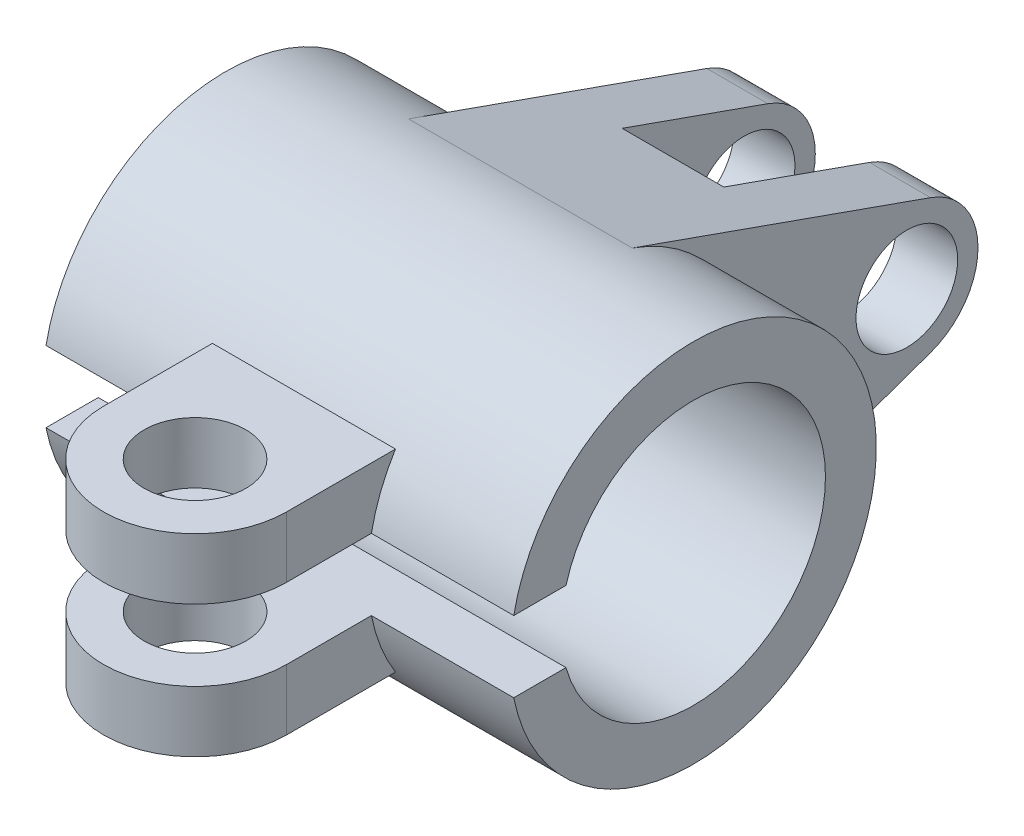
from build123d import *

# Parameters (mm, degrees)
BOSS_EXTRUDE1_DEPTH     = 23
BOSS_EXTRUDE3_DEPTH     = 11
BOSS_EXTRUDE4_START     = 5
SKETCH1_5_R             = 7
SKETCH1_5_R_2           = 5
BOSS_EXTRUDE4_DEPTH     = 6
BOSS_EXTRUDE5_START     = -11
SKETCH1_6_R             = 7
SKETCH1_6_R_2           = 5
BOSS_EXTRUDE5_DEPTH     = 6
BOSS_EXTRUDE6_DEPTH     = 9
FILLET5_RADIUS          = 9
FILLET5_LENGTH          = 6
FILLET6_RADIUS          = 9
FILLET6_LENGTH          = 6
CUT_EXTRUDE1_DEPTH      = 54.714523176
CUT_EXTRUDE1_DEPTH_BACK = 54.714523176
SKETCH3_R               = 5


with BuildPart() as part:
    # Sketch1 → Boss-Extrude1 (new, symmetric)
    with BuildSketch(Plane(origin=(0, 0, 0), x_dir=(0, 0, -1), z_dir=(1, 0, 0))):
        with BuildLine():
            Line((-17.656443583, 3.5), (-12.519984026, 3.5))
            ThreePointArc((-12.519984026, 3.5), (1.766381565, 12.879436951), (13, 0))
            ThreePointArc((13, 0), (1.766381565, -12.879436951), (-12.519984026, -3.5))
            Line((-12.519984026, -3.5), (-17.656443583, -3.5))
            ThreePointArc((-17.656443583, -3.5), (-16.743615691, -6.606915588), (-15.288884851, -9.5))
            ThreePointArc((-15.288884851, -9.5), (-5.96013191, -16.984605607), (6, -16.970562748))
            ThreePointArc((6, -16.970562748), (14.696938457, -10.392304845), (18, 0))
            ThreePointArc((18, 0), (14.696938457, 10.392304845), (6, 16.970562748))
            ThreePointArc((6, 16.970562748), (-5.96013191, 16.984605607), (-15.288884851, 9.5))
            ThreePointArc((-15.288884851, 9.5), (-16.743615691, 6.606915588), (-17.656443583, 3.5))
        make_face()
    extrude(amount=BOSS_EXTRUDE1_DEPTH, both=True)

    # Sketch1<4> → Boss-Extrude3 (add, symmetric)
    with BuildSketch(Plane(origin=(0, 0, 0), x_dir=(0, 0, -1), z_dir=(1, 0, 0))):
        with BuildLine():
            Line((21, 11.66726189), (6, 16.970562748))
            ThreePointArc((6, 16.970562748), (14.696938457, 10.392304845), (18, 0))
            ThreePointArc((18, 0), (14.696938457, -10.392304845), (6, -16.970562748))
            Line((6, -16.970562748), (21, -11.66726189))
            Line((21, -11.66726189), (21, 11.66726189))
        make_face()
    extrude(amount=BOSS_EXTRUDE3_DEPTH, both=True)

    # Sketch1<5> → Boss-Extrude4 (add)
    # profile 1 of 2: a face of its own
    with BuildSketch(Plane(origin=(0, 0, 0), x_dir=(0, 0, -1), z_dir=(1, 0, 0)).offset(BOSS_EXTRUDE4_START)):
        with BuildLine():
            Line((35.333333333, 6.599663291), (21, 11.66726189))
            Line((21, 11.66726189), (21, -11.66726189))
            Line((21, -11.66726189), (35.333333333, -6.599663291))
            ThreePointArc((35.333333333, -6.599663291), (26, 0), (35.333333333, 6.599663291))
        make_face()
    # profile 2 of 2: a face of its own
    with BuildSketch(Plane(origin=(0, 0, 0), x_dir=(0, 0, -1), z_dir=(1, 0, 0)).offset(BOSS_EXTRUDE4_START)):
        with Locations((33, 0)):
            Circle(SKETCH1_5_R)
        with Locations((33, 0)):
            Circle(SKETCH1_5_R_2, mode=Mode.SUBTRACT)
    extrude(amount=BOSS_EXTRUDE4_DEPTH)

    # Sketch1<6> → Boss-Extrude5 (add)
    # profile 1 of 2: a face of its own
    with BuildSketch(Plane(origin=(0, 0, 0), x_dir=(0, 0, -1), z_dir=(1, 0, 0)).offset(BOSS_EXTRUDE5_START)):
        with BuildLine():
            Line((35.333333333, 6.599663291), (21, 11.66726189))
            Line((21, 11.66726189), (21, -11.66726189))
            Line((21, -11.66726189), (35.333333333, -6.599663291))
            ThreePointArc((35.333333333, -6.599663291), (26, 0), (35.333333333, 6.599663291))
        make_face()
    # profile 2 of 2: a face of its own
    with BuildSketch(Plane(origin=(0, 0, 0), x_dir=(0, 0, -1), z_dir=(1, 0, 0)).offset(BOSS_EXTRUDE5_START)):
        with Locations((33, 0)):
            Circle(SKETCH1_6_R)
        with Locations((33, 0)):
            Circle(SKETCH1_6_R_2, mode=Mode.SUBTRACT)
    extrude(amount=BOSS_EXTRUDE5_DEPTH)

    # Sketch1<8> → Boss-Extrude6 (add, symmetric)
    with BuildSketch(Plane(origin=(0, 0, 0), x_dir=(0, 0, -1), z_dir=(1, 0, 0))):
        with BuildLine():
            Line((-35, 3.5), (-17.656443583, 3.5))
            ThreePointArc((-17.656443583, 3.5), (-16.743615691, 6.606915588), (-15.288884851, 9.5))
            Line((-15.288884851, 9.5), (-35, 9.5))
            Line((-35, 9.5), (-35, 3.5))
        make_face()
        with BuildLine():
            ThreePointArc((-15.288884851, -9.5), (-16.743615691, -6.606915588), (-17.656443583, -3.5))
            Line((-17.656443583, -3.5), (-35, -3.5))
            Line((-35, -3.5), (-35, -9.5))
            Line((-35, -9.5), (-15.288884851, -9.5))
        make_face()
    extrude(amount=BOSS_EXTRUDE6_DEPTH, both=True)

    # Fillet5: full round fillet: the end face becomes a half cylinder, R = half its width
    fillet5_face = Plane((0, 6.5, 35), x_dir=(0, 1, 0), z_dir=(0, 0, 1))  # on the end face: x along it, z out of the body
    fillet5_slab = fillet5_face.offset(-FILLET5_RADIUS / 2) * Box(FILLET5_LENGTH, 2 * FILLET5_RADIUS, FILLET5_RADIUS, mode=Mode.PRIVATE)  # the body's end, R deep
    fillet5_round = Plane((0, 6.5, 26), x_dir=(0, 0, 1), z_dir=(0, 1, 0)) * Cylinder(FILLET5_RADIUS, FILLET5_LENGTH, mode=Mode.PRIVATE)  # its axis R under the face
    add(fillet5_slab - fillet5_round, mode=Mode.SUBTRACT)

    # Fillet6: full round fillet: the end face becomes a half cylinder, R = half its width
    fillet6_face = Plane((0, -6.5, 35), x_dir=(0, -1, 0), z_dir=(0, 0, 1))  # on the end face: x along it, z out of the body
    fillet6_slab = fillet6_face.offset(-FILLET6_RADIUS / 2) * Box(FILLET6_LENGTH, 2 * FILLET6_RADIUS, FILLET6_RADIUS, mode=Mode.PRIVATE)  # the body's end, R deep
    fillet6_round = Plane((0, -6.5, 26), x_dir=(0, 0, 1), z_dir=(0, -1, 0)) * Cylinder(FILLET6_RADIUS, FILLET6_LENGTH, mode=Mode.PRIVATE)  # its axis R under the face
    add(fillet6_slab - fillet6_round, mode=Mode.SUBTRACT)

    # Sketch3 → Cut-Extrude1 (cut, two sides: drawn at the far end of the back side and taken through both)
    with BuildSketch(Plane(origin=(0, 9.5, 0), x_dir=(1, 0, 0), z_dir=(0, 1, 0)).offset(-CUT_EXTRUDE1_DEPTH_BACK)):
        with Locations(Location((0, -26, 0), (0, 0, 270))):
            Circle(SKETCH3_R)
    extrude(amount=CUT_EXTRUDE1_DEPTH + CUT_EXTRUDE1_DEPTH_BACK, mode=Mode.SUBTRACT)


solid = part.part
